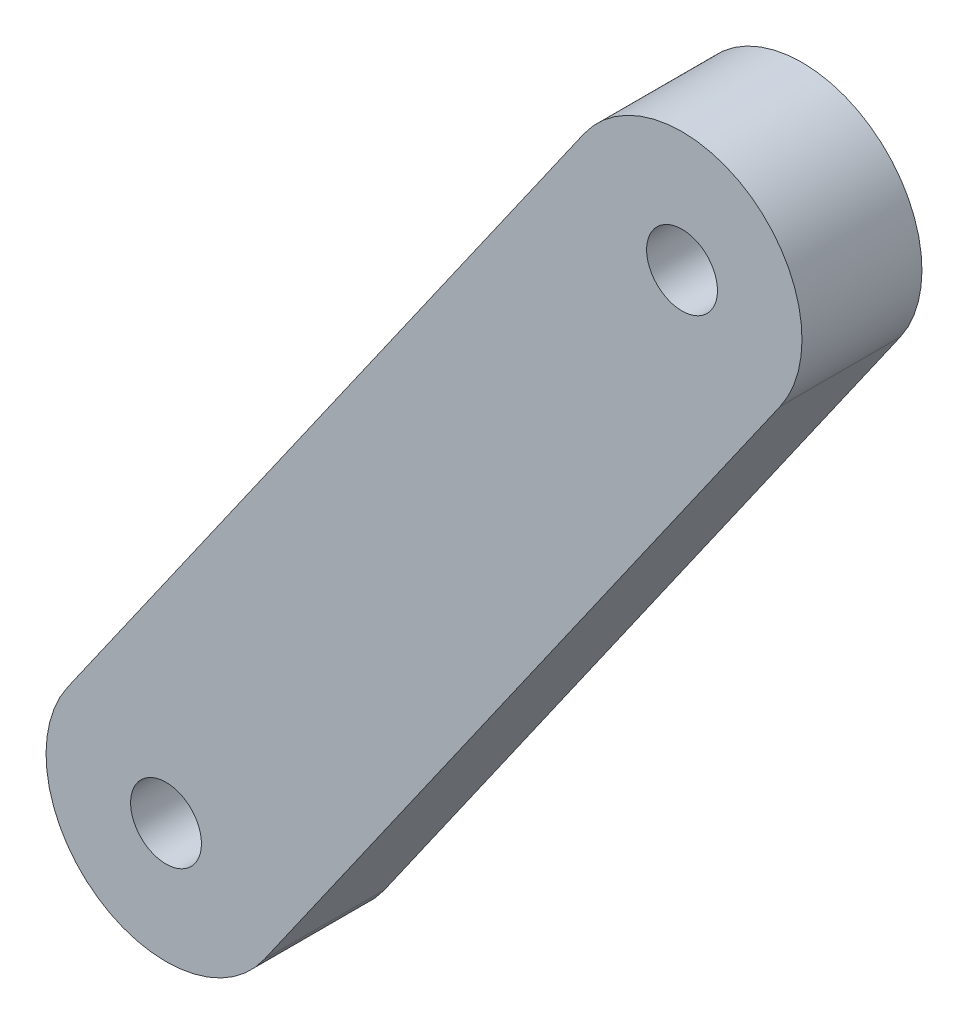
from build123d import *

# Parameters (mm, degrees)
SKETCH2_R           = 1.5
BOSS_EXTRUDE1_DEPTH = 2.54


with BuildPart() as part:
    # Sketch2 → Boss-Extrude1 (new, symmetric)
    with BuildSketch(Plane.XY):
        with BuildLine():
            Line((26.01455461, 28.295924591), (4.161292385, -2.913768297))
            ThreePointArc((4.161292385, -2.913768297), (-2.913768297, -4.161292385), (-4.161292385, 2.913768297))
            Line((-4.161292385, 2.913768297), (17.69196984, 34.123461184))
            ThreePointArc((17.69196984, 34.123461184), (24.767030522, 35.370985272), (26.01455461, 28.295924591))
        make_face()
        with Locations((21.853262225, 31.209692887)):
            Circle(SKETCH2_R, mode=Mode.SUBTRACT)
        Circle(SKETCH2_R, mode=Mode.SUBTRACT)
    extrude(amount=BOSS_EXTRUDE1_DEPTH, both=True)


solid = part.part
